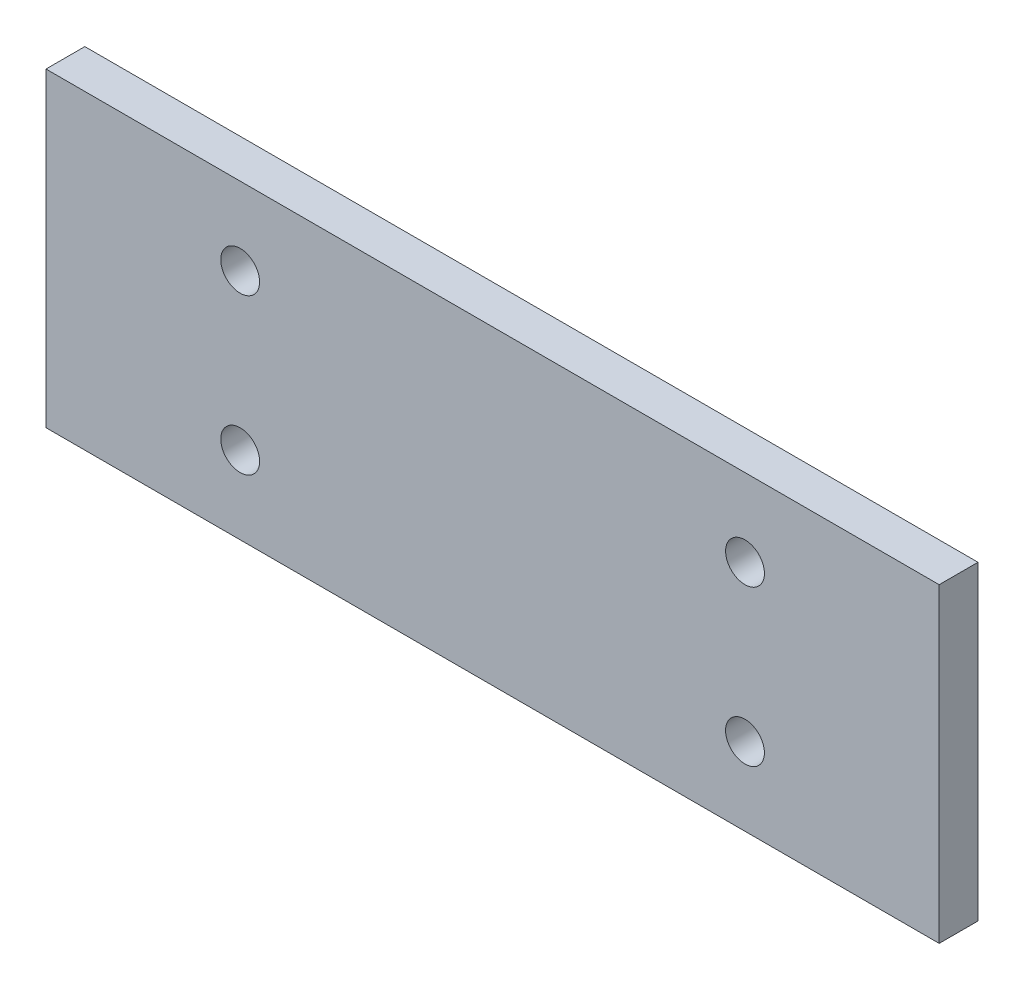
from build123d import *

# Parameters (mm, degrees)
SKETCH1_W           = 115
SKETCH1_H           = 40
BOSS_EXTRUDE1_DEPTH = 5
SKETCH2_R           = 2.5
CUT_EXTRUDE1_DEPTH  = 5


with BuildPart() as part:
    # Sketch1 → Boss-Extrude1 (new body)
    with BuildSketch(Plane.XY):
        Rectangle(SKETCH1_W, SKETCH1_H)
    extrude(amount=BOSS_EXTRUDE1_DEPTH)

    # Sketch2 → Cut-Extrude1 (cut)
    with BuildSketch(Plane(origin=(0, 0, 0), x_dir=(-1, 0, 0), z_dir=(0, 0, -1))):
        with Locations((-32.5, -10)):
            Circle(SKETCH2_R)
        with Locations((32.5, -10)):
            Circle(SKETCH2_R)
        with Locations(Location((32.5, 10, 0), (0, 0, 180))):
            Circle(SKETCH2_R)
        with Locations(Location((-32.5, 10, 0), (0, 0, 180))):
            Circle(SKETCH2_R)
    extrude(amount=-CUT_EXTRUDE1_DEPTH, mode=Mode.SUBTRACT)


solid = part.part
